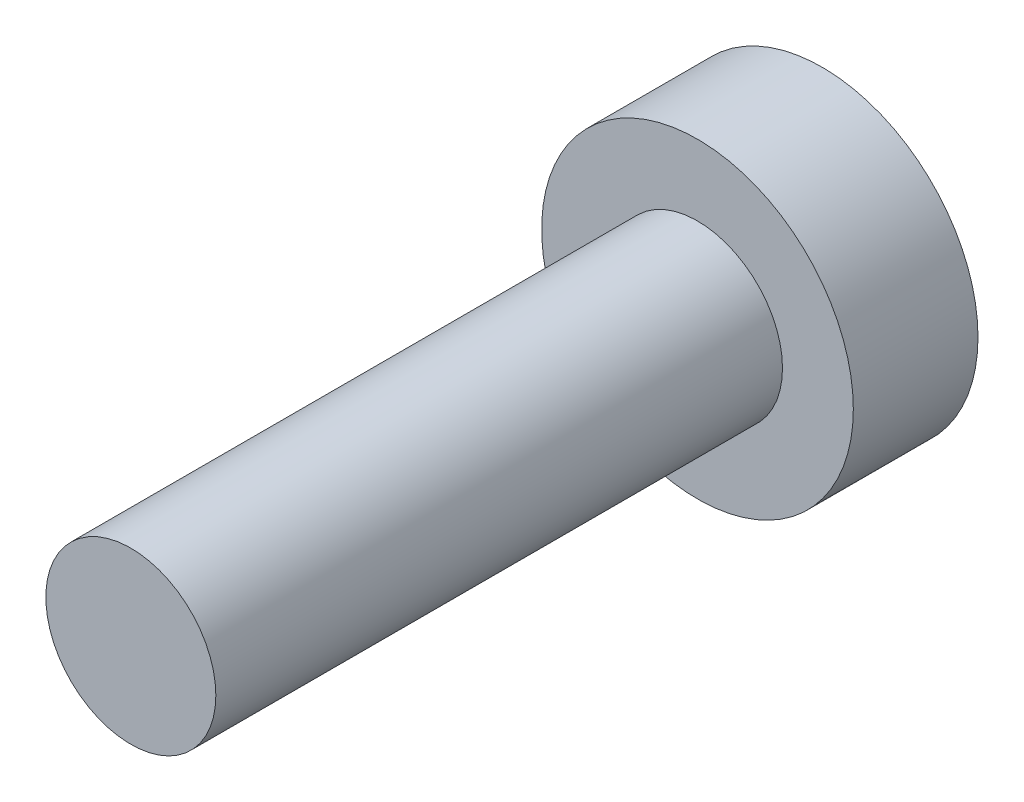
from build123d import *

# Parameters (mm, degrees)
SKETCH_1_R      = 2.75
EXTRUDE_1_DEPTH = 2.2
SKETCH_2_R      = 1.5
EXTRUDE_2_DEPTH = 10


with BuildPart() as part:
    # 草图1 → 凸台-拉伸1 (new body)
    with BuildSketch(Plane.XY):
        Circle(SKETCH_1_R)
    extrude(amount=EXTRUDE_1_DEPTH)

    # 草图2 → 凸台-拉伸2 (add)
    with BuildSketch(Plane.XY.offset(2.2)):
        Circle(SKETCH_2_R)
    extrude(amount=EXTRUDE_2_DEPTH)


solid = part.part
